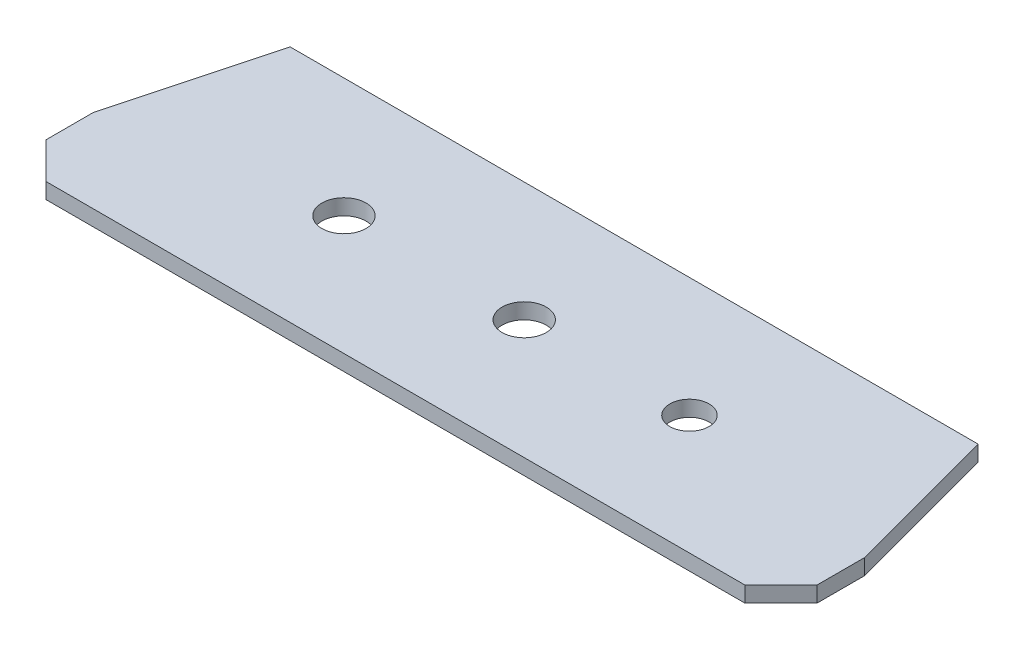
from build123d import *

# Parameters (mm, degrees)
BOSS_EXTRUDE1_DEPTH = 2.54
SKETCH2_R           = 3.571875
SKETCH2_R_2         = 3.175
CUT_EXTRUDE4_DEPTH  = 67.782319344


with BuildPart() as part:
    # Sketch1 → Boss-Extrude1 (new body)
    with BuildSketch(Plane(origin=(0, 0, 0), x_dir=(1, 0, 0), z_dir=(0, 1, 0))):
        Polygon((54.991, -19.304), (60.833, -13.462), (60.833, -5.82667054), (54.102, 19.293763446), (-57.15, 19.293763446), (-63.881, -5.82667054), (-63.881, -13.462), (-58.039, -19.304), align=None)
    extrude(amount=BOSS_EXTRUDE1_DEPTH)

    # Sketch2 → Cut-Extrude4 (cut, through all)
    with BuildSketch(Plane(origin=(0, 2.54, 0), x_dir=(1, 0, 0), z_dir=(0, 1, 0))):
        with Locations(Location((-29.1465, -0.005118277, 0), (0, 0, 270))):
            Circle(SKETCH2_R)
        with Locations(Location((0, 0, 0), (0, 0, 270))):
            Circle(SKETCH2_R)
        with Locations(Location((26.7335, -0.005118277, 0), (0, 0, 270))):
            Circle(SKETCH2_R_2)
    extrude(amount=-CUT_EXTRUDE4_DEPTH, mode=Mode.SUBTRACT)


solid = part.part
